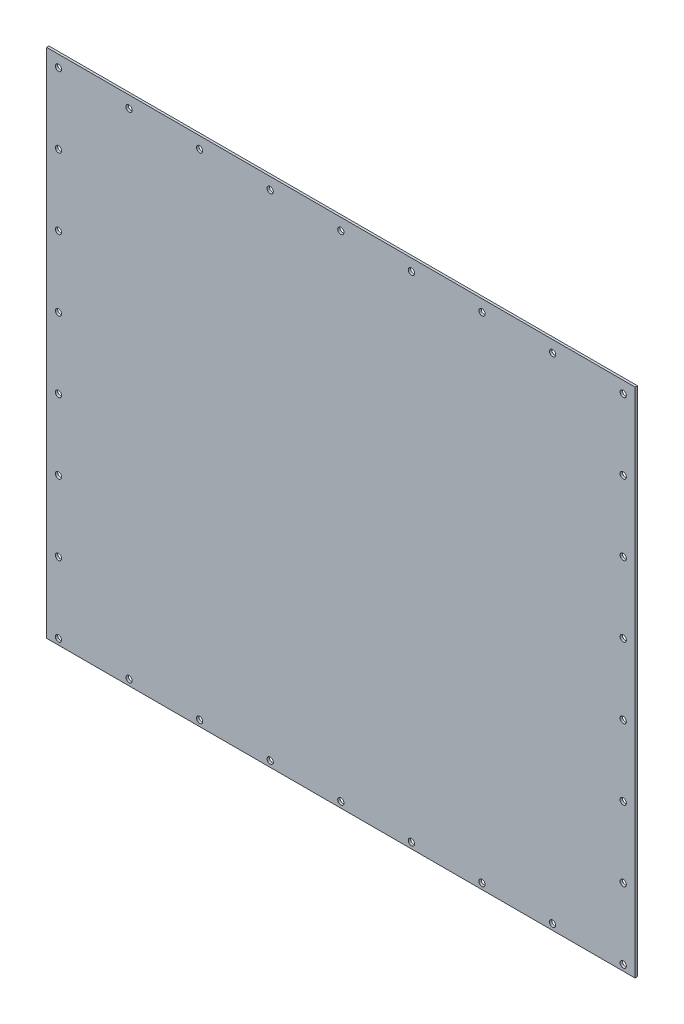
from build123d import *

# Parameters (mm, degrees)
SKETCH1_W            = 500
SKETCH1_H            = 500
BOSS_EXTRUDE1_DEPTH  = 1
LPATTERN1_COUNT      = 9
LPATTERN1_PITCH      = 60
LPATTERN2_COUNT      = 9
LPATTERN2_PITCH      = 60
LPATTERN3_COUNT      = 8
LPATTERN3_PITCH      = 60
LPATTERN3_COUNT_DIR2 = 2
LPATTERN3_PITCH_DIR2 = 60
SKETCH8_W            = 500
SKETCH8_H            = 65
CUT_EXTRUDE3_DEPTH   = 2


with BuildPart() as part:
    # Sketch1 → Boss-Extrude1 (new, symmetric)
    with BuildSketch(Plane.XY):
        Rectangle(SKETCH1_W, SKETCH1_H)
    extrude(amount=BOSS_EXTRUDE1_DEPTH, both=True)

    # Sketch3 → M5 Clearance Hole2 (revolve, cut)
    with BuildSketch(Plane(origin=(-240, -245, 1), x_dir=(0, -1, 0), z_dir=(1, 0, 0))):
        Polygon((0, 0), (0, 9.59228064), (2.65, 8), (2.65, 0), align=None)
    m5_clearance_hole2 = revolve(axis=Axis((-240, -245, 7.35), (0, 0, -1)), mode=Mode.SUBTRACT)

    # LPattern1: M5 Clearance Hole2 ×9
    with Locations(*[(i * LPATTERN1_PITCH, 0, 0) for i in range(1, LPATTERN1_COUNT)]):
        add(m5_clearance_hole2, mode=Mode.SUBTRACT)

    # Sketch6 → M5 Clearance Hole1 (revolve, cut)
    with BuildSketch(Plane(origin=(-240, 175, 1), x_dir=(0, -1, 0), z_dir=(1, 0, 0))):
        Polygon((0, 0), (0, 9.59228064), (2.65, 8), (2.65, 0), align=None)
    m5_clearance_hole1 = revolve(axis=Axis((-240, 175, 7.35), (0, 0, -1)), mode=Mode.SUBTRACT)

    # LPattern2: M5 Clearance Hole1 ×9
    with Locations(*[(i * LPATTERN2_PITCH, 0, 0) for i in range(1, LPATTERN2_COUNT)]):
        add(m5_clearance_hole1, mode=Mode.SUBTRACT)

    # LPattern3: M5 Clearance Hole1 8 × 2
    with Locations(*[Vector(0, -1, 0) * (i * LPATTERN3_PITCH) + Vector(0, 1, 0) * (j * LPATTERN3_PITCH_DIR2) for i in range(LPATTERN3_COUNT) for j in range(LPATTERN3_COUNT_DIR2) if (i, j) != (0, 0)]):
        add(m5_clearance_hole1, mode=Mode.SUBTRACT)

    # Mirror1 copy 1 sketch → Mirror1 copy 1 (revolve, cut)
    with BuildSketch(Plane(origin=(240, 235, 1), x_dir=(0, -1, 0), z_dir=(-1, 0, 0))):
        Polygon((0, 0), (0, -9.59228064), (2.65, -8), (2.65, 0), align=None)
    revolve(axis=Axis((240, 235, 7.35), (0, 0, 1)), mode=Mode.SUBTRACT)

    # Mirror1 copy 2 sketch → Mirror1 copy 2 (revolve, cut)
    with BuildSketch(Plane(origin=(240, 115, 1), x_dir=(0, -1, 0), z_dir=(-1, 0, 0))):
        Polygon((0, 0), (0, -9.59228064), (2.65, -8), (2.65, 0), align=None)
    revolve(axis=Axis((240, 115, 7.35), (0, 0, 1)), mode=Mode.SUBTRACT)

    # Mirror1 copy 3 sketch → Mirror1 copy 3 (revolve, cut)
    with BuildSketch(Plane(origin=(240, 175, 1), x_dir=(0, -1, 0), z_dir=(-1, 0, 0))):
        Polygon((0, 0), (0, -9.59228064), (2.65, -8), (2.65, 0), align=None)
    revolve(axis=Axis((240, 175, 7.35), (0, 0, 1)), mode=Mode.SUBTRACT)

    # Mirror1 copy 4 sketch → Mirror1 copy 4 (revolve, cut)
    with BuildSketch(Plane(origin=(240, 55, 1), x_dir=(0, -1, 0), z_dir=(-1, 0, 0))):
        Polygon((0, 0), (0, -9.59228064), (2.65, -8), (2.65, 0), align=None)
    revolve(axis=Axis((240, 55, 7.35), (0, 0, 1)), mode=Mode.SUBTRACT)

    # Mirror1 copy 5 sketch → Mirror1 copy 5 (revolve, cut)
    with BuildSketch(Plane(origin=(240, 115, 1), x_dir=(0, -1, 0), z_dir=(-1, 0, 0))):
        Polygon((0, 0), (0, -9.59228064), (2.65, -8), (2.65, 0), align=None)
    revolve(axis=Axis((240, 115, 7.35), (0, 0, 1)), mode=Mode.SUBTRACT)

    # Mirror1 copy 6 sketch → Mirror1 copy 6 (revolve, cut)
    with BuildSketch(Plane(origin=(240, -5, 1), x_dir=(0, -1, 0), z_dir=(-1, 0, 0))):
        Polygon((0, 0), (0, -9.59228064), (2.65, -8), (2.65, 0), align=None)
    revolve(axis=Axis((240, -5, 7.35), (0, 0, 1)), mode=Mode.SUBTRACT)

    # Mirror1 copy 7 sketch → Mirror1 copy 7 (revolve, cut)
    with BuildSketch(Plane(origin=(240, 55, 1), x_dir=(0, -1, 0), z_dir=(-1, 0, 0))):
        Polygon((0, 0), (0, -9.59228064), (2.65, -8), (2.65, 0), align=None)
    revolve(axis=Axis((240, 55, 7.35), (0, 0, 1)), mode=Mode.SUBTRACT)

    # Mirror1 copy 8 sketch → Mirror1 copy 8 (revolve, cut)
    with BuildSketch(Plane(origin=(240, -65, 1), x_dir=(0, -1, 0), z_dir=(-1, 0, 0))):
        Polygon((0, 0), (0, -9.59228064), (2.65, -8), (2.65, 0), align=None)
    revolve(axis=Axis((240, -65, 7.35), (0, 0, 1)), mode=Mode.SUBTRACT)

    # Mirror1 copy 9 sketch → Mirror1 copy 9 (revolve, cut)
    with BuildSketch(Plane(origin=(240, -5, 1), x_dir=(0, -1, 0), z_dir=(-1, 0, 0))):
        Polygon((0, 0), (0, -9.59228064), (2.65, -8), (2.65, 0), align=None)
    revolve(axis=Axis((240, -5, 7.35), (0, 0, 1)), mode=Mode.SUBTRACT)

    # Mirror1 copy 10 sketch → Mirror1 copy 10 (revolve, cut)
    with BuildSketch(Plane(origin=(240, -125, 1), x_dir=(0, -1, 0), z_dir=(-1, 0, 0))):
        Polygon((0, 0), (0, -9.59228064), (2.65, -8), (2.65, 0), align=None)
    revolve(axis=Axis((240, -125, 7.35), (0, 0, 1)), mode=Mode.SUBTRACT)

    # Mirror1 copy 11 sketch → Mirror1 copy 11 (revolve, cut)
    with BuildSketch(Plane(origin=(240, -65, 1), x_dir=(0, -1, 0), z_dir=(-1, 0, 0))):
        Polygon((0, 0), (0, -9.59228064), (2.65, -8), (2.65, 0), align=None)
    revolve(axis=Axis((240, -65, 7.35), (0, 0, 1)), mode=Mode.SUBTRACT)

    # Mirror1 copy 12 sketch → Mirror1 copy 12 (revolve, cut)
    with BuildSketch(Plane(origin=(240, -185, 1), x_dir=(0, -1, 0), z_dir=(-1, 0, 0))):
        Polygon((0, 0), (0, -9.59228064), (2.65, -8), (2.65, 0), align=None)
    revolve(axis=Axis((240, -185, 7.35), (0, 0, 1)), mode=Mode.SUBTRACT)

    # Mirror1 copy 13 sketch → Mirror1 copy 13 (revolve, cut)
    with BuildSketch(Plane(origin=(240, -125, 1), x_dir=(0, -1, 0), z_dir=(-1, 0, 0))):
        Polygon((0, 0), (0, -9.59228064), (2.65, -8), (2.65, 0), align=None)
    revolve(axis=Axis((240, -125, 7.35), (0, 0, 1)), mode=Mode.SUBTRACT)

    # Mirror1 copy 14 sketch → Mirror1 copy 14 (revolve, cut)
    with BuildSketch(Plane(origin=(240, -245, 1), x_dir=(0, -1, 0), z_dir=(-1, 0, 0))):
        Polygon((0, 0), (0, -9.59228064), (2.65, -8), (2.65, 0), align=None)
    revolve(axis=Axis((240, -245, 7.35), (0, 0, 1)), mode=Mode.SUBTRACT)

    # Mirror1 copy 15 sketch → Mirror1 copy 15 (revolve, cut)
    with BuildSketch(Plane(origin=(240, -185, 1), x_dir=(0, -1, 0), z_dir=(-1, 0, 0))):
        Polygon((0, 0), (0, -9.59228064), (2.65, -8), (2.65, 0), align=None)
    revolve(axis=Axis((240, -185, 7.35), (0, 0, 1)), mode=Mode.SUBTRACT)

    # Mirror1 copy 16 sketch → Mirror1 copy 16 (revolve, cut)
    with BuildSketch(Plane(origin=(240, 175, 1), x_dir=(0, -1, 0), z_dir=(-1, 0, 0))):
        Polygon((0, 0), (0, -9.59228064), (2.65, -8), (2.65, 0), align=None)
    revolve(axis=Axis((240, 175, 7.35), (0, 0, 1)), mode=Mode.SUBTRACT)

    # Sketch8 → Cut-Extrude3 (cut)
    with BuildSketch(Plane.XY.offset(1)):
        with Locations((0, 217.5)):
            Rectangle(SKETCH8_W, SKETCH8_H)
    extrude(amount=-CUT_EXTRUDE3_DEPTH, mode=Mode.SUBTRACT)


solid = part.part
